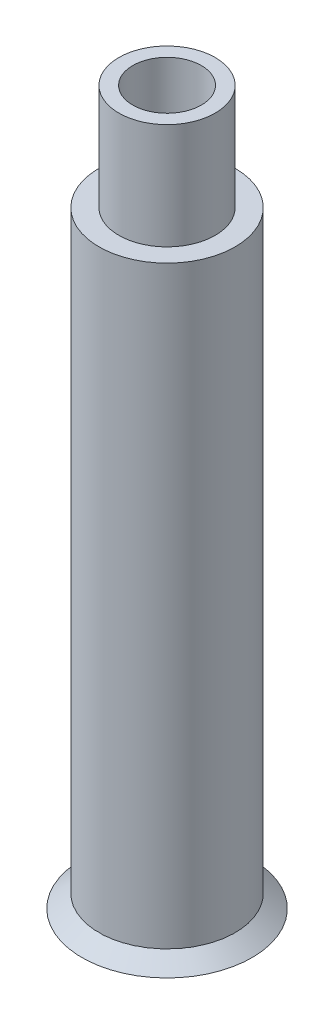
from build123d import *

# Parameters (mm, degrees)
SKETCH1_R           = 6.35
BOSS_EXTRUDE1_DEPTH = 56.642
SKETCH2_W           = 1.2954
SKETCH2_H           = 63.858872161


with BuildPart() as part:
    # Sketch1 → Boss-Extrude1 (new body)
    with BuildSketch(Plane(origin=(0, 0, 0), x_dir=(1, 0, 0), z_dir=(0, 1, 0))):
        with Locations(Location((0, 0, 0), (0, 0, 90))):
            Circle(SKETCH1_R)
    extrude(amount=BOSS_EXTRUDE1_DEPTH)


with BuildPart() as body_2:
    # Sketch2 → Revolve1 (revolve)
    with BuildSketch(Plane(origin=(0, 0, 0), x_dir=(0, 0, -1), z_dir=(1, 0, 0)), mode=Mode.PRIVATE) as revolve1_sk:
        with Locations((-3.8481, 34.59446107)):
            Rectangle(SKETCH2_W, SKETCH2_H)
        Polygon((-4.173535709, 2.274896933), (-3.2004, 2.274896933), (-3.2004, 2.665024989), (-4.4958, 2.665024989), (-7.9375, 0), (-7.8359, 0), align=None)
    revolve(revolve1_sk.sketch.rotate(Axis((0, 0, 0), (0, 1, 0)), 180), axis=Axis((0, 0, 0), (0, 1, 0)))


solid = Compound([part.part, body_2.part])
